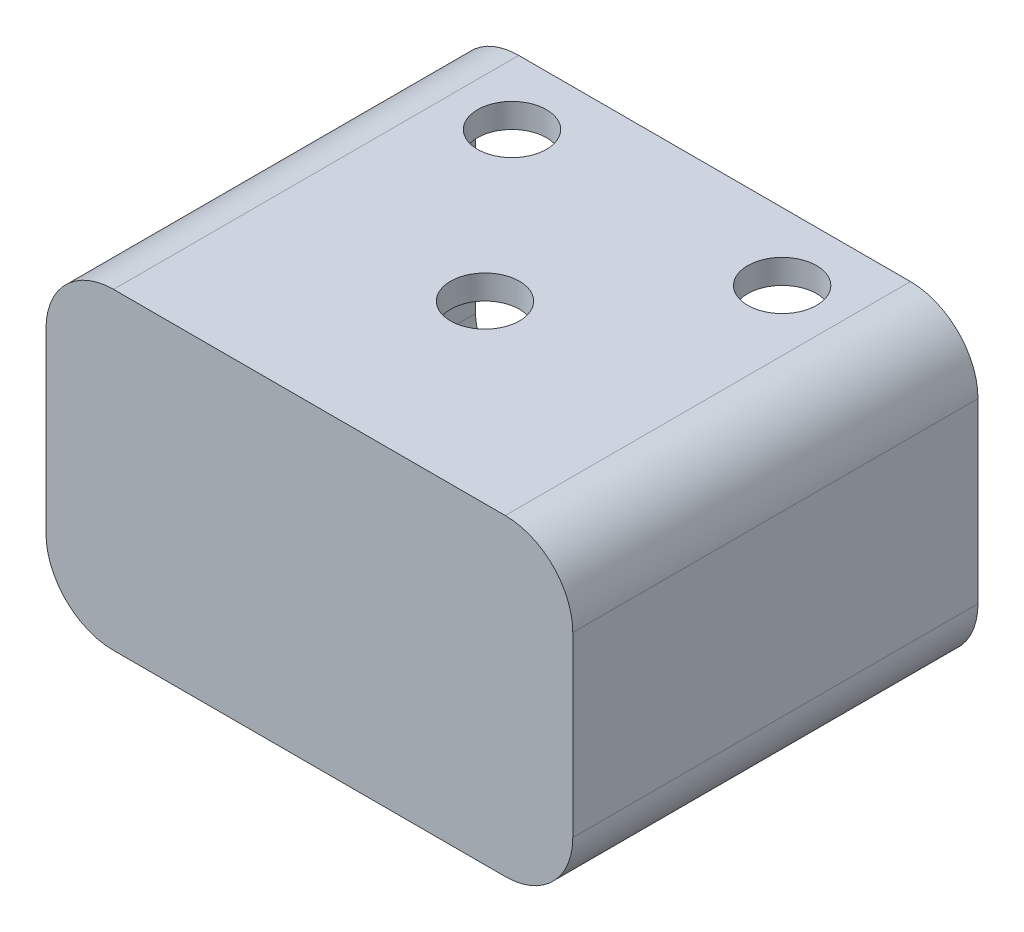
from build123d import *

# Parameters (mm, degrees)
BOSS_EXTRUDE2_DEPTH = 5
BOSS_EXTRUDE3_START = 25
BOSS_EXTRUDE3_DEPTH = 25
SKETCH7_R           = 2.55
CUT_EXTRUDE1_DEPTH  = 313.685484953


with BuildPart() as part:
    # Sketch4 → Boss-Extrude2 (new body)
    with BuildSketch(Plane.XY.offset(304.8)):
        with BuildLine():
            Line((35.5, 1.5), (35.5, 14.65))
            ThreePointArc((35.5, 14.65), (34.035533906, 18.185533906), (30.5, 19.65))
            Line((30.5, 19.65), (1.5, 19.65))
            ThreePointArc((1.5, 19.65), (-2.035533906, 18.185533906), (-3.5, 14.65))
            Line((-3.5, 14.65), (-3.5, 1.5))
            ThreePointArc((-3.5, 1.5), (-2.035533906, -2.035533906), (1.5, -3.5))
            Line((1.5, -3.5), (30.5, -3.5))
            ThreePointArc((30.5, -3.5), (34.035533906, -2.035533906), (35.5, 1.5))
        make_face()
    extrude(amount=BOSS_EXTRUDE2_DEPTH)

    # Sketch6 → Boss-Extrude3 (add)
    with BuildSketch(Plane(origin=(0, 0, 304.8), x_dir=(-1, 0, 0), z_dir=(0, 0, -1)).offset(BOSS_EXTRUDE3_START)):
        with BuildLine():
            Line((-30.5, -3.5), (-1.5, -3.5))
            ThreePointArc((-1.5, -3.5), (2.035533906, -2.035533906), (3.5, 1.5))
            Line((3.5, 1.5), (3.5, 14.65))
            ThreePointArc((3.5, 14.65), (2.035533906, 18.185533906), (-1.5, 19.65))
            Line((-1.5, 19.65), (-30.5, 19.65))
            ThreePointArc((-30.5, 19.65), (-34.035533906, 18.185533906), (-35.5, 14.65))
            Line((-35.5, 14.65), (-35.5, 1.5))
            ThreePointArc((-35.5, 1.5), (-34.035533906, -2.035533906), (-30.5, -3.5))
        make_face()
        with BuildLine():
            Line((-1.5, 17.85), (-30.5, 17.85))
            ThreePointArc((-30.5, 17.85), (-32.7627417, 16.9127417), (-33.7, 14.65))
            Line((-33.7, 14.65), (-33.7, 1.5))
            ThreePointArc((-33.7, 1.5), (-32.7627417, -0.7627417), (-30.5, -1.7))
            Line((-30.5, -1.7), (-1.5, -1.7))
            ThreePointArc((-1.5, -1.7), (0.7627417, -0.7627417), (1.7, 1.5))
            Line((1.7, 1.5), (1.7, 14.65))
            ThreePointArc((1.7, 14.65), (0.7627417, 16.9127417), (-1.5, 17.85))
        make_face(mode=Mode.SUBTRACT)
    extrude(amount=-BOSS_EXTRUDE3_DEPTH)

    # Sketch7 → Cut-Extrude1 (cut, through all)
    with BuildSketch(Plane(origin=(0, 19.65, 0), x_dir=(1, 0, 0), z_dir=(0, 1, 0))):
        with Locations(Location((16, -296.8, 0), (0, 0, 180))):
            Circle(SKETCH7_R)
        with Locations(Location((26, -284.8, 0), (0, 0, 180))):
            Circle(SKETCH7_R)
        with Locations(Location((6, -284.8, 0), (0, 0, 180))):
            Circle(SKETCH7_R)
    extrude(amount=-CUT_EXTRUDE1_DEPTH, mode=Mode.SUBTRACT)


solid = part.part
